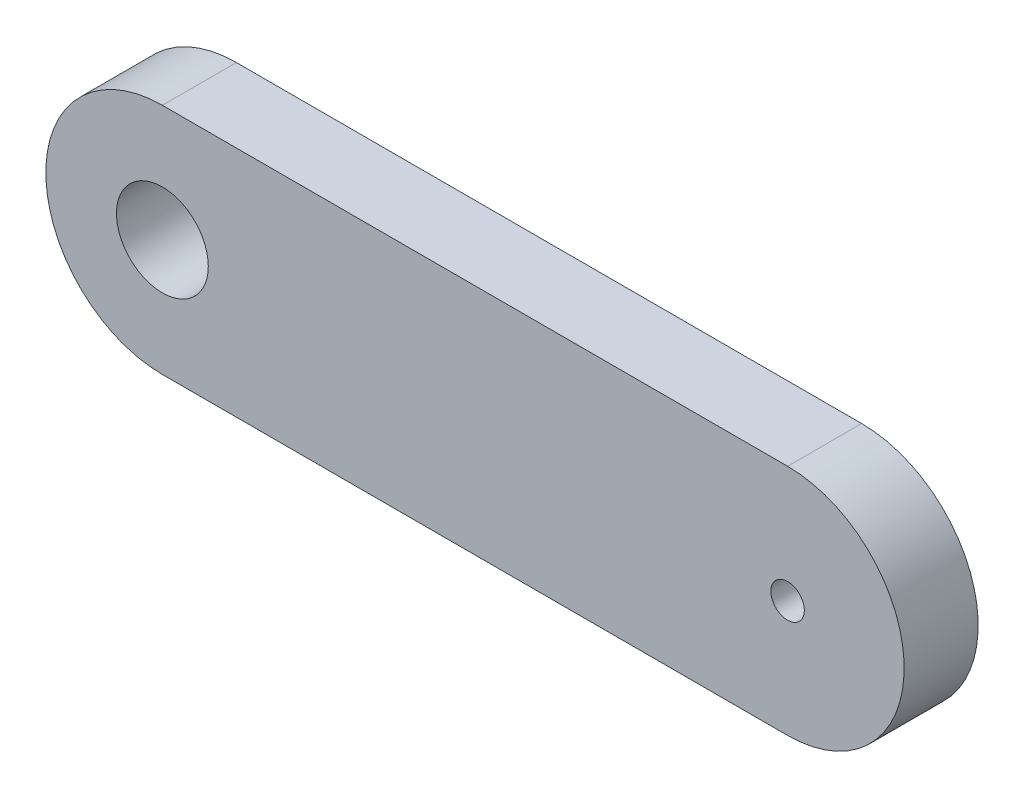
from build123d import *

# Parameters (mm, degrees)
SKETCH1_R           = 3.9375
SKETCH1_R_2         = 1.4375
BOSS_EXTRUDE1_DEPTH = 6.35


with BuildPart() as part:
    # Sketch1 → Boss-Extrude1 (new body)
    with BuildSketch(Plane.XY):
        with BuildLine():
            Line((-26.81729841, 10), (26.81729841, 10))
            ThreePointArc((26.81729841, 10), (36.81729841, 0), (26.81729841, -10))
            Line((26.81729841, -10), (-26.81729841, -10))
            ThreePointArc((-26.81729841, -10), (-36.81729841, 0), (-26.81729841, 10))
        make_face()
        with Locations((-26.81729841, 0)):
            Circle(SKETCH1_R, mode=Mode.SUBTRACT)
        with Locations((26.81729841, 0)):
            Circle(SKETCH1_R_2, mode=Mode.SUBTRACT)
    extrude(amount=BOSS_EXTRUDE1_DEPTH)


solid = part.part
